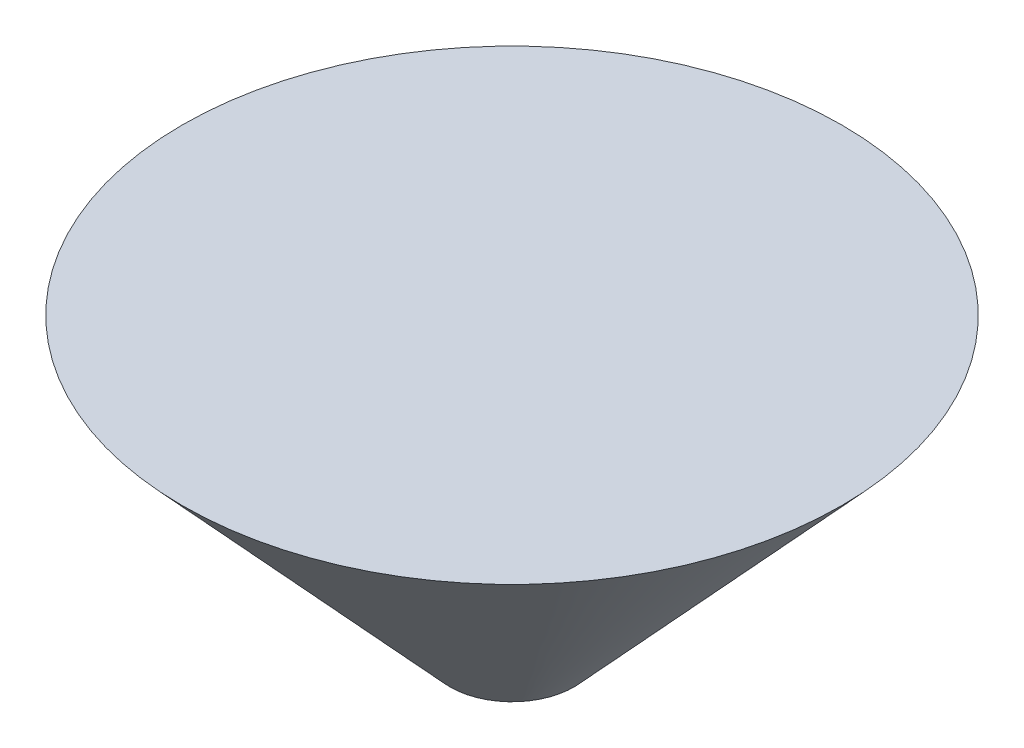
from build123d import *


with BuildPart() as part:
    # Sketch1 → Cono_de_union (revolve)
    with BuildSketch(Plane.XY, mode=Mode.PRIVATE) as cono_de_union_sk:
        Polygon((0, 0), (17, 0), (3.2, -15), (0, -15), align=None)
    revolve(cono_de_union_sk.sketch.rotate(Axis((0, -19, 0), (0, 1, 0)), 270), axis=Axis((0, -19, 0), (0, 1, 0)))


solid = part.part
